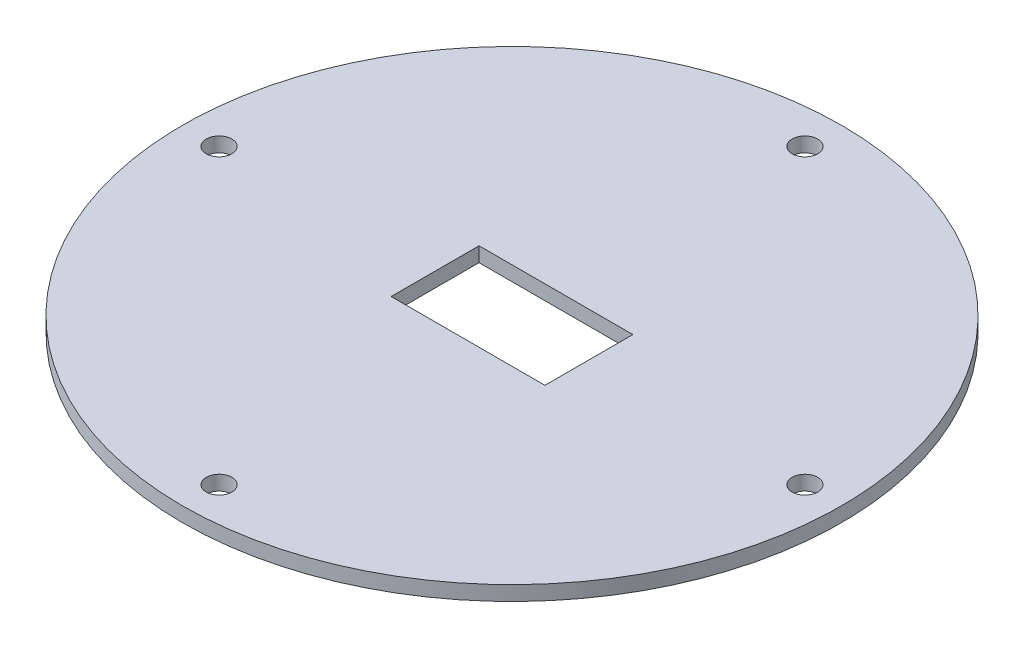
from build123d import *

# Parameters (mm, degrees)
SKETCH1_R           = 45
BOSS_EXTRUDE1_DEPTH = 2
SKETCH2_R           = 1.75
CUT_EXTRUDE1_DEPTH  = 64.671029519
SKETCH3_W           = 21
SKETCH3_H           = 12
CUT_EXTRUDE2_DEPTH  = 64.671029519


with BuildPart() as part:
    # Sketch1 → Boss-Extrude1 (new body)
    with BuildSketch(Plane(origin=(0, 0, 0), x_dir=(1, 0, 0), z_dir=(0, 1, 0))):
        with Locations(Location((0, 0, 0), (0, 0, 270))):
            Circle(SKETCH1_R)
    extrude(amount=BOSS_EXTRUDE1_DEPTH)

    # Sketch2 → Cut-Extrude1 (cut, through all)
    with BuildSketch(Plane(origin=(0, 2, 0), x_dir=(1, 0, 0), z_dir=(0, 1, 0))):
        with Locations(Location((0, 40, 0), (0, 0, 270))):
            Circle(SKETCH2_R)
        with Locations(Location((40, 0, 0), (0, 0, 270))):
            Circle(SKETCH2_R)
        with Locations(Location((0, -40, 0), (0, 0, 270))):
            Circle(SKETCH2_R)
        with Locations(Location((-40, 0, 0), (0, 0, 270))):
            Circle(SKETCH2_R)
    extrude(amount=-CUT_EXTRUDE1_DEPTH, mode=Mode.SUBTRACT)

    # Sketch3 → Cut-Extrude2 (cut, through all)
    with BuildSketch(Plane(origin=(0, 2, 0), x_dir=(1, 0, 0), z_dir=(0, 1, 0))):
        Rectangle(SKETCH3_W, SKETCH3_H)
    extrude(amount=-CUT_EXTRUDE2_DEPTH, mode=Mode.SUBTRACT)


solid = part.part
